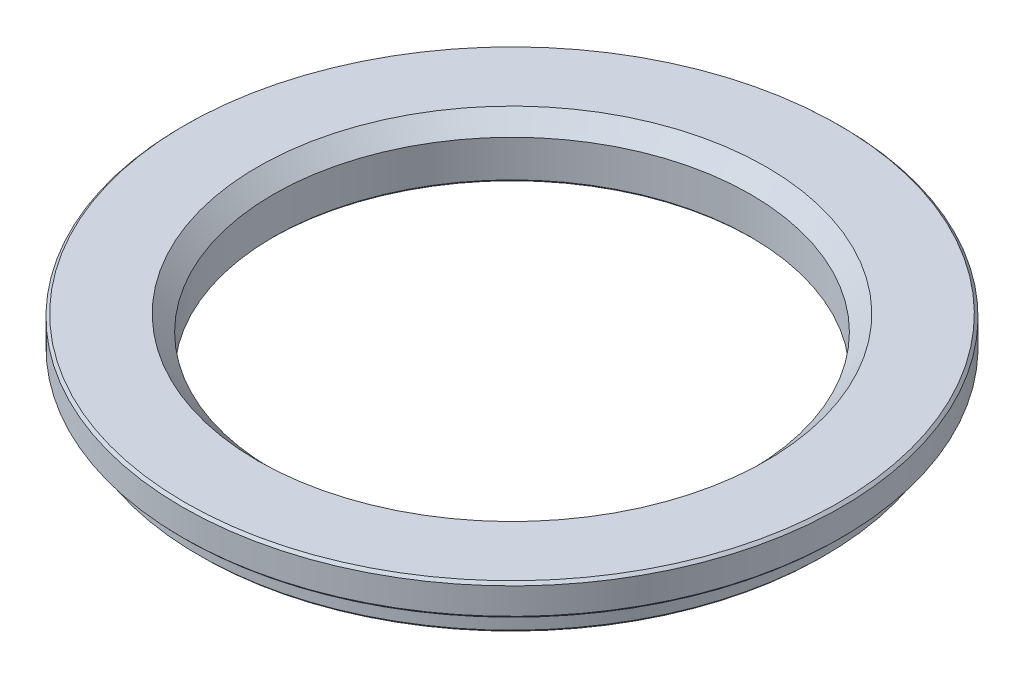
from build123d import *

# Parameters (mm, degrees)
CHANFRO1_SIZE = 3
CHANFRO2_SIZE = 0.5


with BuildPart() as part:
    # Esboço1 → Revolução1 (revolve)
    with BuildSketch(Plane.XY, mode=Mode.PRIVATE) as revolu_o1_sk:
        Polygon((45.25, 9.444130676), (62.5, 9.444130676), (62.5, 3.444130676), (59.356423034, 3.444130676), (59.356423034, -1.055869324), (45.25, -1.055869324), align=None)
    revolve(revolu_o1_sk.sketch.rotate(Axis((0, -46.025193798, 0), (0, 1, 0)), 90), axis=Axis((0, -46.025193798, 0), (0, 1, 0)))

    # Chanfro1
    chanfro1_edges = [part.edges().sort_by_distance(p)[0] for p in [
        (0, 9.444130676, 45.25),
    ]]
    chamfer(chanfro1_edges, length=CHANFRO1_SIZE)

    # Chanfro2
    chanfro2_edges = [part.edges().sort_by_distance(p)[0] for p in [
        (0, -1.055869324, 45.25),
        (0, -1.055869324, 59.356423034),
        (0, 3.444130676, 62.5),
        (0, 9.444130676, 62.5),
    ]]
    chamfer(chanfro2_edges, length=CHANFRO2_SIZE)


solid = part.part
